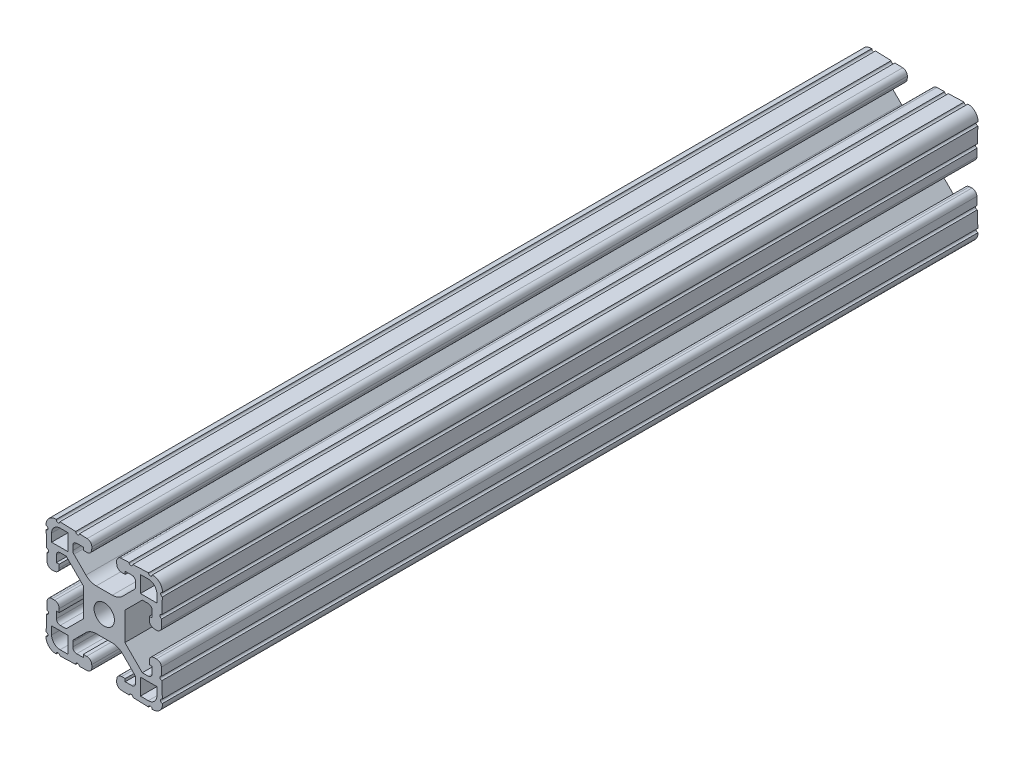
from build123d import *

# Parameters (mm, degrees)
SKETCH3_R      = 3.3274
EXTRUDE1_DEPTH = 133.35


with BuildPart() as part:
    # Sketch3 → Extrude1 (new, symmetric)
    with BuildSketch(Plane.XY):
        with BuildLine():
            Line((-2.633706952, 6.7564), (2.633706952, 6.7564))
            ThreePointArc((2.633706952, 6.7564), (4.451376719, 7.117956996), (5.992322742, 8.147584211))
            Line((5.992322742, 8.147584211), (9.915025612, 12.070287081))
            ThreePointArc((9.915025612, 12.070287081), (10.190327006, 12.482304734), (10.287, 12.968312693))
            Line((10.287, 12.968312693), (10.287, 14.374526586))
            ThreePointArc((10.287, 14.374526586), (9.915025612, 15.272552198), (9.017, 15.644526586))
            Line((9.017, 15.644526586), (6.858, 15.644526586))
            Line((6.858, 15.644526586), (6.858, 14.732540373))
            Line((6.858, 14.732540373), (5.721166713, 14.732540373))
            ThreePointArc((5.721166713, 14.732540373), (4.592195968, 15.154645238), (4.092366311, 16.25142132))
            Line((4.092366311, 16.25142132), (4.064, 17.063726184))
            ThreePointArc((4.064, 17.063726184), (4.486104865, 18.192696929), (5.582880947, 18.692526586))
            Line((5.582880947, 18.692526586), (8.126437228, 18.781349529))
            ThreePointArc((8.126437228, 18.781349529), (8.756940609, 18.193395614), (9.344894524, 18.823898995))
            Line((9.344894524, 18.823898995), (14.476437228, 19.003096415))
            ThreePointArc((14.476437228, 19.003096415), (15.106940609, 18.4151425), (15.694894524, 19.045645881))
            Line((15.694894524, 19.045645881), (15.764194098, 19.048065876))
            ThreePointArc((15.764194098, 19.048065876), (18.12006403, 18.12006403), (19.048065876, 15.764194098))
            Line((19.048065876, 15.764194098), (19.045645881, 15.694894524))
            ThreePointArc((19.045645881, 15.694894524), (18.4151425, 15.106940609), (19.003096415, 14.476437228))
            Line((19.003096415, 14.476437228), (18.823898995, 9.344894524))
            ThreePointArc((18.823898995, 9.344894524), (18.193395614, 8.756940609), (18.781349529, 8.126437228))
            Line((18.781349529, 8.126437228), (18.692526586, 5.582880947))
            ThreePointArc((18.692526586, 5.582880947), (18.192696929, 4.486104865), (17.063726184, 4.064))
            Line((17.063726184, 4.064), (16.25142132, 4.092366311))
            ThreePointArc((16.25142132, 4.092366311), (15.154645238, 4.592195968), (14.732540373, 5.721166713))
            Line((14.732540373, 5.721166713), (14.732540373, 6.858))
            Line((14.732540373, 6.858), (15.644526586, 6.858))
            Line((15.644526586, 6.858), (15.644526586, 9.017))
            ThreePointArc((15.644526586, 9.017), (15.272552198, 9.915025612), (14.374526586, 10.287))
            Line((14.374526586, 10.287), (12.442261469, 10.287))
            Line((12.442261469, 10.287), (6.7564, 4.601138531))
            Line((6.7564, 4.601138531), (6.7564, -4.601138531))
            Line((6.7564, -4.601138531), (12.442261469, -10.287))
            Line((12.442261469, -10.287), (14.374526586, -10.287))
            ThreePointArc((14.374526586, -10.287), (15.272552198, -9.915025612), (15.644526586, -9.017))
            Line((15.644526586, -9.017), (15.644526586, -6.858))
            Line((15.644526586, -6.858), (14.732540373, -6.858))
            Line((14.732540373, -6.858), (14.732540373, -5.721166713))
            ThreePointArc((14.732540373, -5.721166713), (15.154645238, -4.592195968), (16.25142132, -4.092366311))
            Line((16.25142132, -4.092366311), (17.063726184, -4.064))
            ThreePointArc((17.063726184, -4.064), (18.192696929, -4.486104865), (18.692526586, -5.582880947))
            Line((18.692526586, -5.582880947), (18.781349529, -8.126437228))
            ThreePointArc((18.781349529, -8.126437228), (18.193395614, -8.756940609), (18.823898995, -9.344894524))
            Line((18.823898995, -9.344894524), (19.003096415, -14.476437228))
            ThreePointArc((19.003096415, -14.476437228), (18.4151425, -15.106940609), (19.045645881, -15.694894524))
            Line((19.045645881, -15.694894524), (19.048065876, -15.764194098))
            ThreePointArc((19.048065876, -15.764194098), (18.12006403, -18.12006403), (15.764194098, -19.048065876))
            Line((15.764194098, -19.048065876), (15.694894524, -19.045645881))
            ThreePointArc((15.694894524, -19.045645881), (15.106940609, -18.4151425), (14.476437228, -19.003096415))
            Line((14.476437228, -19.003096415), (9.344894524, -18.823898995))
            ThreePointArc((9.344894524, -18.823898995), (8.756940609, -18.193395614), (8.126437228, -18.781349529))
            Line((8.126437228, -18.781349529), (5.582880947, -18.692526586))
            ThreePointArc((5.582880947, -18.692526586), (4.486104865, -18.192696929), (4.064, -17.063726184))
            Line((4.064, -17.063726184), (4.092366311, -16.25142132))
            ThreePointArc((4.092366311, -16.25142132), (4.592195968, -15.154645238), (5.721166713, -14.732540373))
            Line((5.721166713, -14.732540373), (6.858, -14.732540373))
            Line((6.858, -14.732540373), (6.858, -15.644526586))
            Line((6.858, -15.644526586), (9.017, -15.644526586))
            ThreePointArc((9.017, -15.644526586), (9.915025612, -15.272552198), (10.287, -14.374526586))
            Line((10.287, -14.374526586), (10.287, -12.968312693))
            ThreePointArc((10.287, -12.968312693), (10.190327006, -12.482304734), (9.915025612, -12.070287081))
            Line((9.915025612, -12.070287081), (5.992322742, -8.147584211))
            ThreePointArc((5.992322742, -8.147584211), (4.451376719, -7.117956996), (2.633706952, -6.7564))
            Line((2.633706952, -6.7564), (-2.633706952, -6.7564))
            ThreePointArc((-2.633706952, -6.7564), (-4.451376719, -7.117956996), (-5.992322742, -8.147584211))
            Line((-5.992322742, -8.147584211), (-9.915025612, -12.070287081))
            ThreePointArc((-9.915025612, -12.070287081), (-10.190327006, -12.482304734), (-10.287, -12.968312693))
            Line((-10.287, -12.968312693), (-10.287, -14.374526586))
            ThreePointArc((-10.287, -14.374526586), (-9.915025612, -15.272552198), (-9.017, -15.644526586))
            Line((-9.017, -15.644526586), (-6.858, -15.644526586))
            Line((-6.858, -15.644526586), (-6.858, -14.732540373))
            Line((-6.858, -14.732540373), (-5.721166713, -14.732540373))
            ThreePointArc((-5.721166713, -14.732540373), (-4.592195968, -15.154645238), (-4.092366311, -16.25142132))
            Line((-4.092366311, -16.25142132), (-4.064, -17.063726184))
            ThreePointArc((-4.064, -17.063726184), (-4.486104865, -18.192696929), (-5.582880947, -18.692526586))
            Line((-5.582880947, -18.692526586), (-8.126437228, -18.781349529))
            ThreePointArc((-8.126437228, -18.781349529), (-8.756940609, -18.193395614), (-9.344894524, -18.823898995))
            Line((-9.344894524, -18.823898995), (-14.476437228, -19.003096415))
            ThreePointArc((-14.476437228, -19.003096415), (-15.106940609, -18.4151425), (-15.694894524, -19.045645881))
            Line((-15.694894524, -19.045645881), (-15.764194098, -19.048065876))
            ThreePointArc((-15.764194098, -19.048065876), (-18.12006403, -18.12006403), (-19.048065876, -15.764194098))
            Line((-19.048065876, -15.764194098), (-19.045645881, -15.694894524))
            ThreePointArc((-19.045645881, -15.694894524), (-18.4151425, -15.106940609), (-19.003096415, -14.476437228))
            Line((-19.003096415, -14.476437228), (-18.823898995, -9.344894524))
            ThreePointArc((-18.823898995, -9.344894524), (-18.193395614, -8.756940609), (-18.781349529, -8.126437228))
            Line((-18.781349529, -8.126437228), (-18.692526586, -5.582880947))
            ThreePointArc((-18.692526586, -5.582880947), (-18.192696929, -4.486104865), (-17.063726184, -4.064))
            Line((-17.063726184, -4.064), (-16.25142132, -4.092366311))
            ThreePointArc((-16.25142132, -4.092366311), (-15.154645238, -4.592195968), (-14.732540373, -5.721166713))
            Line((-14.732540373, -5.721166713), (-14.732540373, -6.858))
            Line((-14.732540373, -6.858), (-15.644526586, -6.858))
            Line((-15.644526586, -6.858), (-15.644526586, -9.017))
            ThreePointArc((-15.644526586, -9.017), (-15.272552198, -9.915025612), (-14.374526586, -10.287))
            Line((-14.374526586, -10.287), (-12.442261469, -10.287))
            Line((-12.442261469, -10.287), (-6.7564, -4.601138531))
            Line((-6.7564, -4.601138531), (-6.7564, 4.601138531))
            Line((-6.7564, 4.601138531), (-12.442261469, 10.287))
            Line((-12.442261469, 10.287), (-14.374526586, 10.287))
            ThreePointArc((-14.374526586, 10.287), (-15.272552198, 9.915025612), (-15.644526586, 9.017))
            Line((-15.644526586, 9.017), (-15.644526586, 6.858))
            Line((-15.644526586, 6.858), (-14.732540373, 6.858))
            Line((-14.732540373, 6.858), (-14.732540373, 5.721166713))
            ThreePointArc((-14.732540373, 5.721166713), (-15.154645238, 4.592195968), (-16.25142132, 4.092366311))
            Line((-16.25142132, 4.092366311), (-17.063726184, 4.064))
            ThreePointArc((-17.063726184, 4.064), (-18.192696929, 4.486104865), (-18.692526586, 5.582880947))
            Line((-18.692526586, 5.582880947), (-18.781349529, 8.126437228))
            ThreePointArc((-18.781349529, 8.126437228), (-18.193395614, 8.756940609), (-18.823898995, 9.344894524))
            Line((-18.823898995, 9.344894524), (-19.003096415, 14.476437228))
            ThreePointArc((-19.003096415, 14.476437228), (-18.4151425, 15.106940609), (-19.045645881, 15.694894524))
            Line((-19.045645881, 15.694894524), (-19.048065876, 15.764194098))
            ThreePointArc((-19.048065876, 15.764194098), (-18.12006403, 18.12006403), (-15.764194098, 19.048065876))
            Line((-15.764194098, 19.048065876), (-15.694894524, 19.045645881))
            ThreePointArc((-15.694894524, 19.045645881), (-15.106940609, 18.4151425), (-14.476437228, 19.003096415))
            Line((-14.476437228, 19.003096415), (-9.344894524, 18.823898995))
            ThreePointArc((-9.344894524, 18.823898995), (-8.756940609, 18.193395614), (-8.126437228, 18.781349529))
            Line((-8.126437228, 18.781349529), (-5.582880947, 18.692526586))
            ThreePointArc((-5.582880947, 18.692526586), (-4.486104865, 18.192696929), (-4.064, 17.063726184))
            Line((-4.064, 17.063726184), (-4.092366311, 16.25142132))
            ThreePointArc((-4.092366311, 16.25142132), (-4.592195968, 15.154645238), (-5.721166713, 14.732540373))
            Line((-5.721166713, 14.732540373), (-6.858, 14.732540373))
            Line((-6.858, 14.732540373), (-6.858, 15.644526586))
            Line((-6.858, 15.644526586), (-9.017, 15.644526586))
            ThreePointArc((-9.017, 15.644526586), (-9.915025612, 15.272552198), (-10.287, 14.374526586))
            Line((-10.287, 14.374526586), (-10.287, 12.968312693))
            ThreePointArc((-10.287, 12.968312693), (-10.190327006, 12.482304734), (-9.915025612, 12.070287081))
            Line((-9.915025612, 12.070287081), (-5.992322742, 8.147584211))
            ThreePointArc((-5.992322742, 8.147584211), (-4.451376719, 7.117956996), (-2.633706952, 6.7564))
        make_face()
        Circle(SKETCH3_R, mode=Mode.SUBTRACT)
        with BuildLine():
            Line((-11.8364, 11.8364), (-11.8364, 17.2212))
            Line((-11.8364, 17.2212), (-14.4272, 17.2212))
            ThreePointArc((-14.4272, 17.2212), (-16.402856347, 16.402856347), (-17.2212, 14.4272))
            Line((-17.2212, 14.4272), (-17.2212, 11.8364))
            Line((-17.2212, 11.8364), (-11.8364, 11.8364))
        make_face(mode=Mode.SUBTRACT)
        with BuildLine():
            Line((11.8364, 17.2212), (14.4272, 17.2212))
            ThreePointArc((14.4272, 17.2212), (16.402856347, 16.402856347), (17.2212, 14.4272))
            Line((17.2212, 14.4272), (17.2212, 11.8364))
            Line((17.2212, 11.8364), (11.8364, 11.8364))
            Line((11.8364, 11.8364), (11.8364, 17.2212))
        make_face(mode=Mode.SUBTRACT)
        with BuildLine():
            Line((11.8364, -11.8364), (11.8364, -17.2212))
            Line((11.8364, -17.2212), (14.4272, -17.2212))
            ThreePointArc((14.4272, -17.2212), (16.402856347, -16.402856347), (17.2212, -14.4272))
            Line((17.2212, -14.4272), (17.2212, -11.8364))
            Line((17.2212, -11.8364), (11.8364, -11.8364))
        make_face(mode=Mode.SUBTRACT)
        with BuildLine():
            Line((-11.8364, -17.2212), (-14.4272, -17.2212))
            ThreePointArc((-14.4272, -17.2212), (-16.402856347, -16.402856347), (-17.2212, -14.4272))
            Line((-17.2212, -14.4272), (-17.2212, -11.8364))
            Line((-17.2212, -11.8364), (-11.8364, -11.8364))
            Line((-11.8364, -11.8364), (-11.8364, -17.2212))
        make_face(mode=Mode.SUBTRACT)
    extrude(amount=EXTRUDE1_DEPTH, both=True)


solid = part.part
